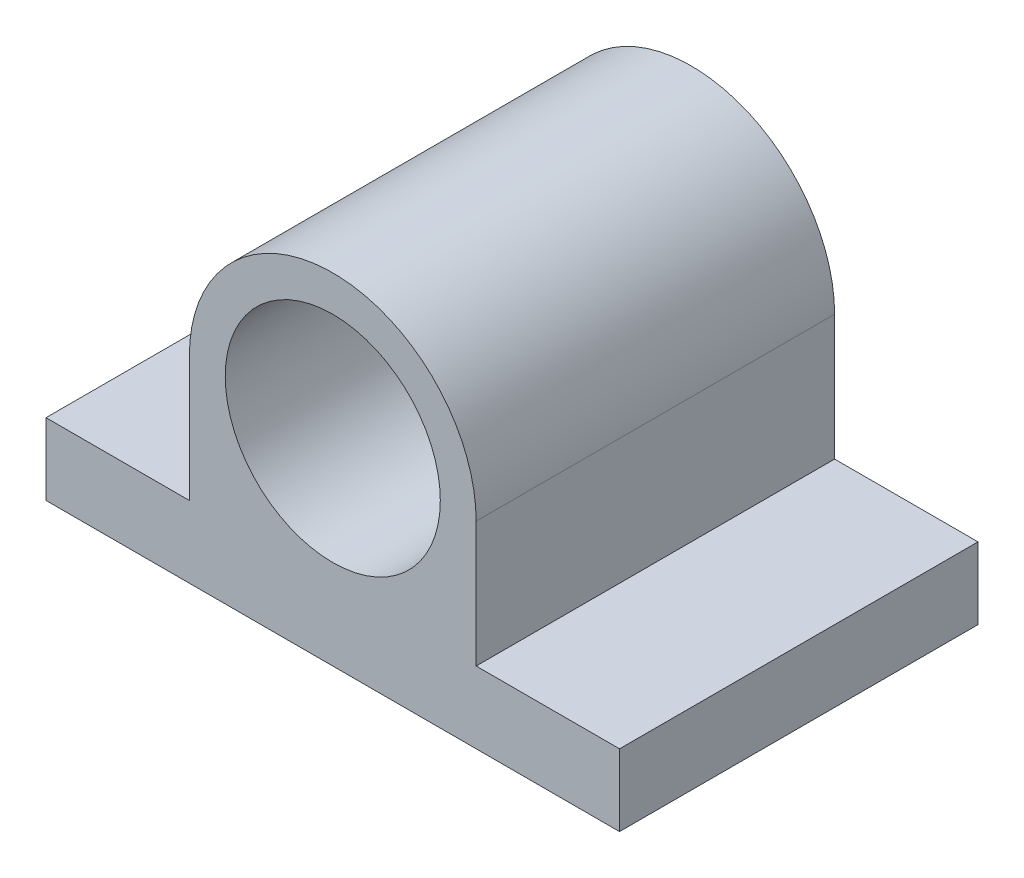
from build123d import *

# Parameters (mm, degrees)
SKETCH1_R           = 15
BOSS_EXTRUDE1_DEPTH = 50


with BuildPart() as part:
    # Sketch1 → Boss-Extrude1 (new body)
    with BuildSketch(Plane.XY):
        with BuildLine():
            Line((0, 0), (80, 0))
            Line((80, 0), (80, 10))
            Line((80, 10), (60, 10))
            Line((60, 10), (60, 27.5))
            ThreePointArc((60, 27.5), (40, 47.5), (20, 27.5))
            Line((20, 27.5), (20, 10))
            Line((20, 10), (0, 10))
            Line((0, 10), (0, 0))
        make_face()
        with Locations((40, 27.5)):
            Circle(SKETCH1_R, mode=Mode.SUBTRACT)
    extrude(amount=BOSS_EXTRUDE1_DEPTH)


solid = part.part
